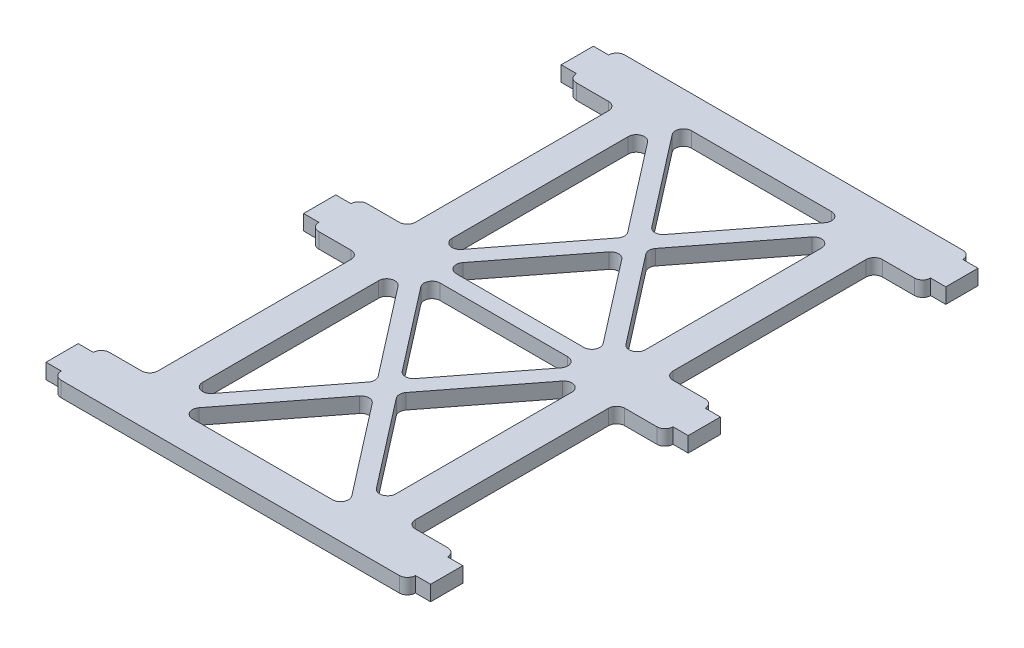
from build123d import *

# Parameters (mm, degrees)
SKETCH1_W           = 50.8
SKETCH1_H           = 111.125
BOSS_EXTRUDE1_DEPTH = 1.5
SKETCH2_W           = 9.525
SKETCH2_H           = 9.525
BOSS_EXTRUDE2_DEPTH = 3
CUT_EXTRUDE1_DEPTH  = 3
FILLET1_R           = 1.5875
SKETCH5_W           = 3
SKETCH5_H           = 6.35
BOSS_EXTRUDE3_DEPTH = 3


with BuildPart() as part:
    # Sketch1 → Boss-Extrude1 (new, symmetric)
    with BuildSketch(Plane(origin=(0, 34.29, 0), x_dir=(1, 0, 0), z_dir=(0, 1, 0))):
        with Locations((0, 120.65)):
            Rectangle(SKETCH1_W, SKETCH1_H)
    extrude(amount=BOSS_EXTRUDE1_DEPTH, both=True)

    # Sketch2 → Boss-Extrude2 (add)
    with BuildSketch(Plane(origin=(0, 35.79, 0), x_dir=(1, 0, 0), z_dir=(0, 1, 0))):
        with Locations((30.1625, 171.45)):
            Rectangle(SKETCH2_W, SKETCH2_H)
        with Locations((-30.1625, 171.45)):
            Rectangle(SKETCH2_W, SKETCH2_H)
        with Locations((30.1625, 120.65)):
            Rectangle(SKETCH2_W, SKETCH2_H)
        with Locations((-30.1625, 120.65)):
            Rectangle(SKETCH2_W, SKETCH2_H)
        with Locations((30.1625, 69.85)):
            Rectangle(SKETCH2_W, SKETCH2_H)
        with Locations((-30.1625, 69.85)):
            Rectangle(SKETCH2_W, SKETCH2_H)
    extrude(amount=-BOSS_EXTRUDE2_DEPTH)

    # Sketch4 → Cut-Extrude1 (cut)
    with BuildSketch(Plane(origin=(0, 35.79, 0), x_dir=(1, 0, 0), z_dir=(0, 1, 0))):
        Polygon((17.042345512, 169.8625), (-17.042345512, 169.8625), (0, 147.84947038), align=None)
        Polygon((-2.007654488, 145.25625), (-19.05, 167.26927962), (-19.05, 123.24322038), align=None)
        Polygon((19.05, 167.26927962), (2.007654488, 145.25625), (19.05, 123.24322038), align=None)
        Polygon((15.813313254, 122.2375), (0, 142.66302962), (-15.813313254, 122.2375), align=None)
        Polygon((-2.007654488, 96.04375), (-19.05, 118.05677962), (-19.05, 74.03072038), align=None)
        Polygon((15.813313254, 119.0625), (-15.813313254, 119.0625), (0, 98.63697038), align=None)
        Polygon((19.05, 74.03072038), (19.05, 118.05677962), (2.007654488, 96.04375), align=None)
        Polygon((17.042345512, 71.4375), (0, 93.45052962), (-17.042345512, 71.4375), align=None)
    extrude(amount=-CUT_EXTRUDE1_DEPTH, mode=Mode.SUBTRACT)

    # Fillet1
    fillet1_edges = [part.edges().sort_by_distance(p)[0] for p in [
        (15.813313254, 34.29, -122.2375),
        (-15.813313254, 34.29, -122.2375),
        (0, 34.29, -142.66302962),
        (15.813313254, 34.29, -119.0625),
        (0, 34.29, -98.63697038),
        (-15.813313254, 34.29, -119.0625),
        (17.042345512, 34.29, -71.4375),
        (-17.042345512, 34.29, -71.4375),
        (0, 34.29, -93.45052962),
        (-2.007654488, 34.29, -96.04375),
        (-19.05, 34.29, -74.03072038),
        (-19.05, 34.29, -118.05677962),
        (-2.007654488, 34.29, -145.25625),
        (-19.05, 34.29, -123.24322038),
        (-19.05, 34.29, -167.26927962),
        (19.05, 34.29, -123.24322038),
        (2.007654488, 34.29, -145.25625),
        (19.05, 34.29, -167.26927962),
        (0, 34.29, -147.84947038),
        (-17.042345512, 34.29, -169.8625),
        (17.042345512, 34.29, -169.8625),
        (19.05, 34.29, -118.05677962),
        (19.05, 34.29, -74.03072038),
        (2.007654488, 34.29, -96.04375),
        (34.925, 34.29, -65.0875),
        (34.925, 34.29, -74.6125),
        (25.4, 34.29, -74.6125),
        (-25.4, 34.29, -115.8875),
        (-25.4, 34.29, -125.4125),
        (-34.925, 34.29, -125.4125),
        (-34.925, 34.29, -115.8875),
        (34.925, 34.29, -115.8875),
        (34.925, 34.29, -125.4125),
        (25.4, 34.29, -125.4125),
        (25.4, 34.29, -115.8875),
        (-25.4, 34.29, -166.6875),
        (-34.925, 34.29, -176.2125),
        (-34.925, 34.29, -166.6875),
        (-25.4, 34.29, -74.6125),
        (-34.925, 34.29, -74.6125),
        (-34.925, 34.29, -65.0875),
        (34.925, 34.29, -166.6875),
        (34.925, 34.29, -176.2125),
        (25.4, 34.29, -166.6875),
    ]]
    fillet(fillet1_edges, radius=FILLET1_R)

    # Sketch5 → Boss-Extrude3 (add)
    with BuildSketch(Plane(origin=(0, 35.79, 0), x_dir=(1, 0, 0), z_dir=(0, 1, 0))):
        with Locations((36.425, 171.45)):
            Rectangle(SKETCH5_W, SKETCH5_H)
        with Locations((-36.425, 171.45)):
            Rectangle(SKETCH5_W, SKETCH5_H)
        with Locations((36.425, 120.65)):
            Rectangle(SKETCH5_W, SKETCH5_H)
        with Locations((-36.425, 120.65)):
            Rectangle(SKETCH5_W, SKETCH5_H)
        with Locations((36.425, 69.85)):
            Rectangle(SKETCH5_W, SKETCH5_H)
        with Locations((-36.425, 69.85)):
            Rectangle(SKETCH5_W, SKETCH5_H)
    extrude(amount=-BOSS_EXTRUDE3_DEPTH)


solid = part.part
